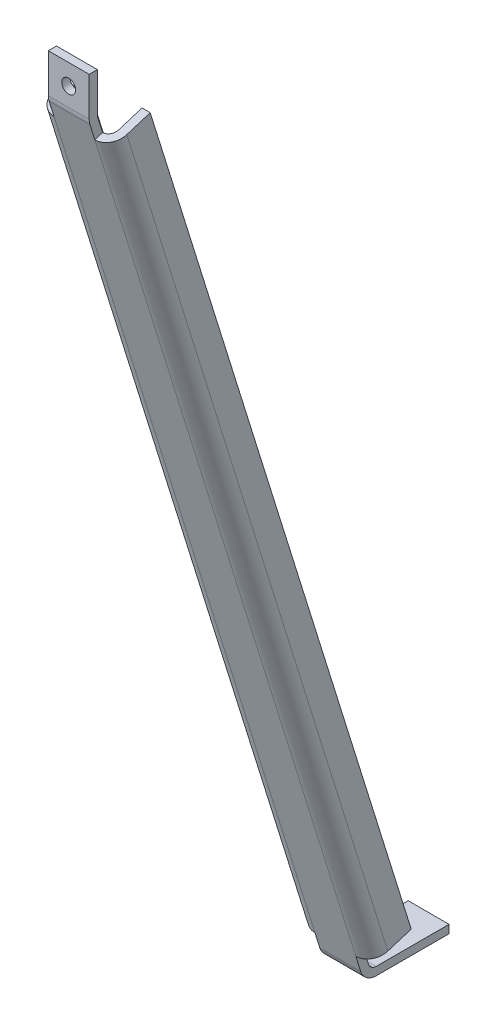
from build123d import *

# Parameters (mm, degrees)
FORMED_WEB_DEPTH           = 10
EDGE_STIFFENING_LIPS_DEPTH = 214.533668262
WALL_MOUNT_HOLE_SKETCH_R   = 1.7
WALL_MOUNT_HOLES_DEPTH     = 2.4
COVER_MOUNT_HOLE_SKETCH_R  = 1.7
COVER_MOUNT_HOLE_DEPTH     = 2.4


with BuildPart() as part:
    # Formed Web Section Sketch → Formed Web (new body)
    with BuildSketch(Plane(origin=(185, 0, 0), x_dir=(0, 0, -1), z_dir=(1, 0, 0))):
        with BuildLine():
            Line((-22, 64), (-39.792590359, 64))
            ThreePointArc((-39.792590359, 64), (-42.163216653, 64.778178935), (-43.611457224, 66.809934512))
            Line((-43.611457224, 66.809934512), (-109.818866865, 279.266547538))
            ThreePointArc((-109.818866865, 279.266547538), (-109.954457451, 279.854727432), (-110, 280.456613027))
            Line((-110, 280.456613027), (-110, 290))
            Line((-110, 290), (-108, 290))
            Line((-108, 290), (-108, 280.456613027))
            ThreePointArc((-108, 280.456613027), (-107.977228725, 280.155670229), (-107.909433433, 279.861580283))
            Line((-107.909433433, 279.861580283), (-41.702023792, 67.404967256))
            ThreePointArc((-41.702023792, 67.404967256), (-40.977903506, 66.389089467), (-39.792590359, 66))
            Line((-39.792590359, 66), (-22, 66))
            Line((-22, 66), (-22, 64))
        make_face()
    extrude(amount=FORMED_WEB_DEPTH)

    # Edge Lip Sketch → Edge Stiffening Lips (add)
    with BuildSketch(Plane(origin=(0, 77.102620151, 24.02732814), x_dir=(-1, 0, 0), z_dir=(0, -0.9547167162884552, -0.297516372052681))):
        with BuildLine():
            Line((-181, -17.759537901), (-181, -11.759537901))
            Line((-181, -11.759537901), (-183, -11.759537901))
            Line((-183, -11.759537901), (-183, -17.759537901))
            ThreePointArc((-183, -17.759537901), (-183.585786438, -19.173751463), (-185, -19.759537901))
            Line((-185, -19.759537901), (-185.1, -19.759537901))
            Line((-185.1, -19.759537901), (-185.1, -21.759537901))
            Line((-185.1, -21.759537901), (-185, -21.759537901))
            ThreePointArc((-185, -21.759537901), (-182.171572875, -20.587965025), (-181, -17.759537901))
        make_face()
        with BuildLine():
            Line((-199, -17.759537901), (-199, -11.759537901))
            Line((-199, -11.759537901), (-197, -11.759537901))
            Line((-197, -11.759537901), (-197, -17.759537901))
            ThreePointArc((-197, -17.759537901), (-196.414213562, -19.173751463), (-195, -19.759537901))
            Line((-195, -19.759537901), (-194.9, -19.759537901))
            Line((-194.9, -19.759537901), (-194.9, -21.759537901))
            Line((-194.9, -21.759537901), (-195, -21.759537901))
            ThreePointArc((-195, -21.759537901), (-197.828427125, -20.587965025), (-199, -17.759537901))
        make_face()
    extrude(amount=-EDGE_STIFFENING_LIPS_DEPTH)

    # Wall Mount Hole Sketch → Wall Mount Holes (cut)
    with BuildSketch(Plane(origin=(0, 63.8, 0), x_dir=(-1, 0, 0), z_dir=(0, -1, 0))):
        with Locations(Location((-190, -29, 0), (0, 0, 90))):
            Circle(WALL_MOUNT_HOLE_SKETCH_R)
        with Locations(Location((-190, -36, 0), (0, 0, 90))):
            Circle(WALL_MOUNT_HOLE_SKETCH_R)
    extrude(amount=-WALL_MOUNT_HOLES_DEPTH, mode=Mode.SUBTRACT)

    # Cover Mount Hole Sketch → Cover Mount Hole (cut)
    with BuildSketch(Plane.XY.offset(107.8)):
        with Locations(Location((190, 285, 0), (0, 0, 180))):
            Circle(COVER_MOUNT_HOLE_SKETCH_R)
    extrude(amount=COVER_MOUNT_HOLE_DEPTH, mode=Mode.SUBTRACT)


solid = part.part
